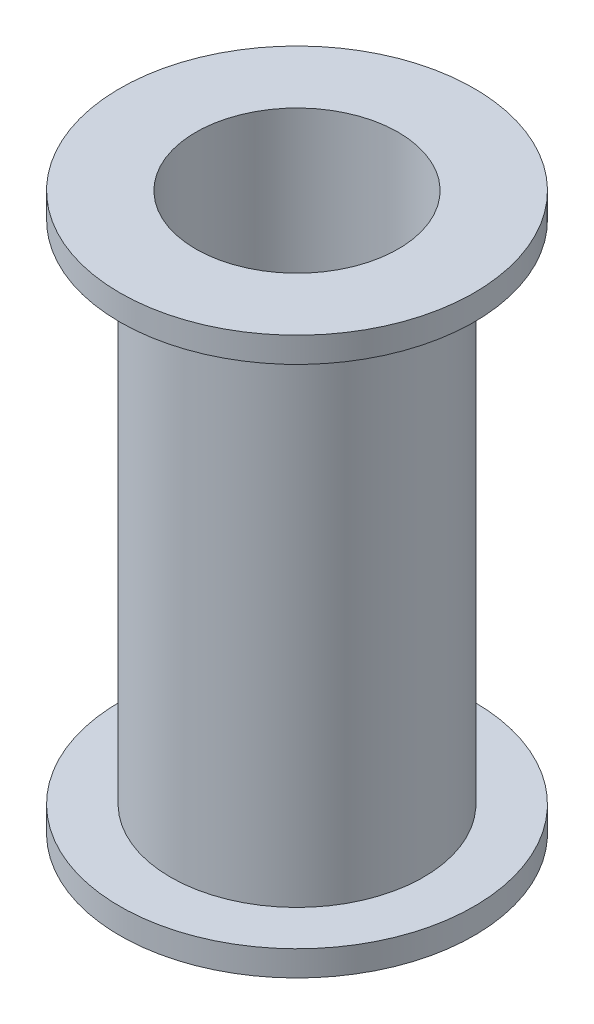
from build123d import *

# Parameters (mm, degrees)
ESBO_O1_R                = 50
RESSALTO_EXTRUS_O2_DEPTH = 200
ESBO_O5_R                = 70
RESSALTO_EXTRUS_O3_DEPTH = 10
RESSALTO_EXTRUS_O4_START = 10
ESBO_O6_R                = 70
RESSALTO_EXTRUS_O4_DEPTH = 10
ESBO_O7_R                = 40
CORTE_EXTRUS_O3_DEPTH    = 220


with BuildPart() as part:
    # Esboço1 → Ressalto-extrusão2 (new body)
    with BuildSketch(Plane(origin=(0, 0, 0), x_dir=(1, 0, 0), z_dir=(0, 1, 0))):
        with Locations(Location((0, 0, 0), (0, 0, 270))):
            Circle(ESBO_O1_R)
    extrude(amount=RESSALTO_EXTRUS_O2_DEPTH)

    # Esboço5 → Ressalto-extrusão3 (add)
    with BuildSketch(Plane(origin=(0, 200, 0), x_dir=(1, 0, 0), z_dir=(0, 1, 0))):
        with Locations(Location((0, 0, 0), (0, 0, 270))):
            Circle(ESBO_O5_R)
    extrude(amount=RESSALTO_EXTRUS_O3_DEPTH)

    # Esboço6 → Ressalto-extrusão4 (add)
    with BuildSketch(Plane(origin=(0, 0, 0), x_dir=(-1, 0, 0), z_dir=(0, -1, 0)).offset(RESSALTO_EXTRUS_O4_START)):
        with Locations(Location((0, 0, 0), (0, 0, 270))):
            Circle(ESBO_O6_R)
    extrude(amount=-RESSALTO_EXTRUS_O4_DEPTH)

    # Esboço7 → Corte-extrusão3 (cut)
    with BuildSketch(Plane(origin=(0, -10, 0), x_dir=(-1, 0, 0), z_dir=(0, -1, 0))):
        with Locations(Location((0, 0, 0), (0, 0, 90))):
            Circle(ESBO_O7_R)
    extrude(amount=-CORTE_EXTRUS_O3_DEPTH, mode=Mode.SUBTRACT)


solid = part.part
